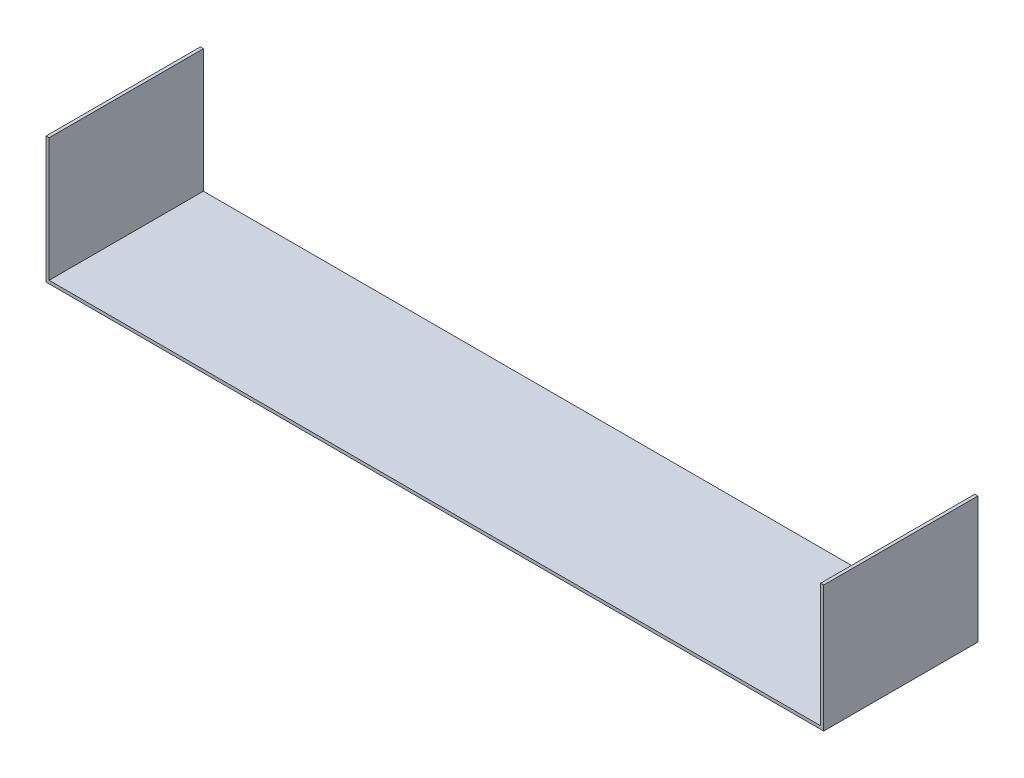
from build123d import *

# Parameters (mm, degrees)
BOSS_EXTRUDE1_DEPTH = 10000


with BuildPart() as part:
    # Sketch2 → Boss-Extrude1 (new body)
    with BuildSketch(Plane.XY):
        Polygon((0, 0), (0, -8000), (50000, -8000), (50000, 0), (50200, 0), (50200, -8200), (-200, -8200), (-200, 0), align=None)
    extrude(amount=-BOSS_EXTRUDE1_DEPTH)


solid = part.part
